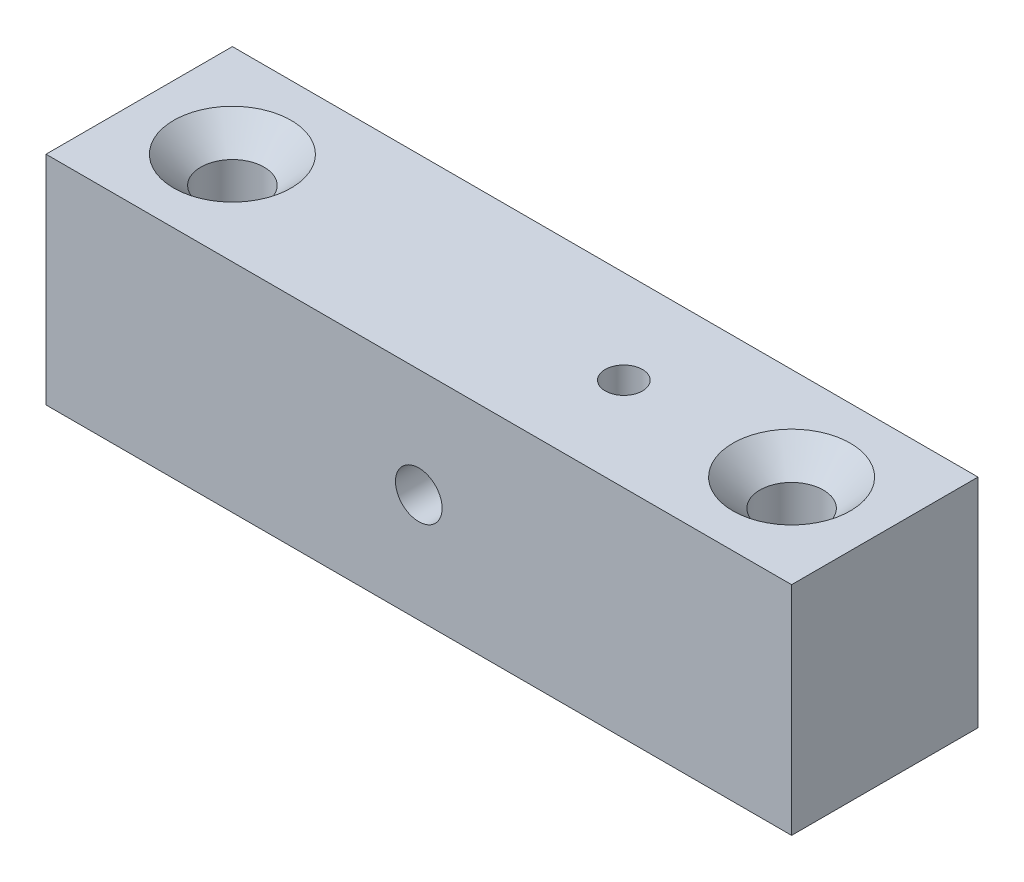
from build123d import *

# Parameters (mm, degrees)
SKETCH1_W                                       = 40
SKETCH1_H                                       = 10
BOSS_EXTRUDE1_DEPTH                             = 11.65
CSK_FOR_M3_FLAT_HEAD_MACHINE_SCREW1_D           = 3.4
CSK_FOR_M3_FLAT_HEAD_MACHINE_SCREW1_CSINK_D     = 6.3
CSK_FOR_M3_FLAT_HEAD_MACHINE_SCREW1_CSINK_ANGLE = 90
M3X0_5_TAPPED_HOLE1_D                           = 2.5
F_2_0MM_DOWEL_HOLE1_D                           = 2


with BuildPart() as part:
    # Sketch1 → Boss-Extrude1 (new body)
    with BuildSketch(Plane(origin=(0, 0, 0), x_dir=(1, 0, 0), z_dir=(0, 1, 0))):
        with Locations((20, 5)):
            Rectangle(SKETCH1_W, SKETCH1_H)
    extrude(amount=BOSS_EXTRUDE1_DEPTH)

    # CSK for M3 Flat Head Machine Screw1 (through all)
    with Locations(Plane(origin=(5, 11.65, -5), x_dir=(0, 0, 1), z_dir=(0, 1, 0))):
        with Locations((0, 0), (0, 30)):
            CounterSinkHole(CSK_FOR_M3_FLAT_HEAD_MACHINE_SCREW1_D / 2, CSK_FOR_M3_FLAT_HEAD_MACHINE_SCREW1_CSINK_D / 2, counter_sink_angle=CSK_FOR_M3_FLAT_HEAD_MACHINE_SCREW1_CSINK_ANGLE)

    # M3x0.5 Tapped Hole1 (through all)
    with Locations(Plane(origin=(20, 5.825, -10), x_dir=(-1, 0, 0), z_dir=(0, 0, -1))):
        with Locations((0, 0)):
            Hole(M3X0_5_TAPPED_HOLE1_D / 2)

    # Ø2.0mm Dowel Hole1 (through all)
    with Locations(Plane(origin=(26, 11.65, -5), x_dir=(0, 0, 1), z_dir=(0, 1, 0))):
        with Locations((0, 0)):
            Hole(F_2_0MM_DOWEL_HOLE1_D / 2)


solid = part.part
